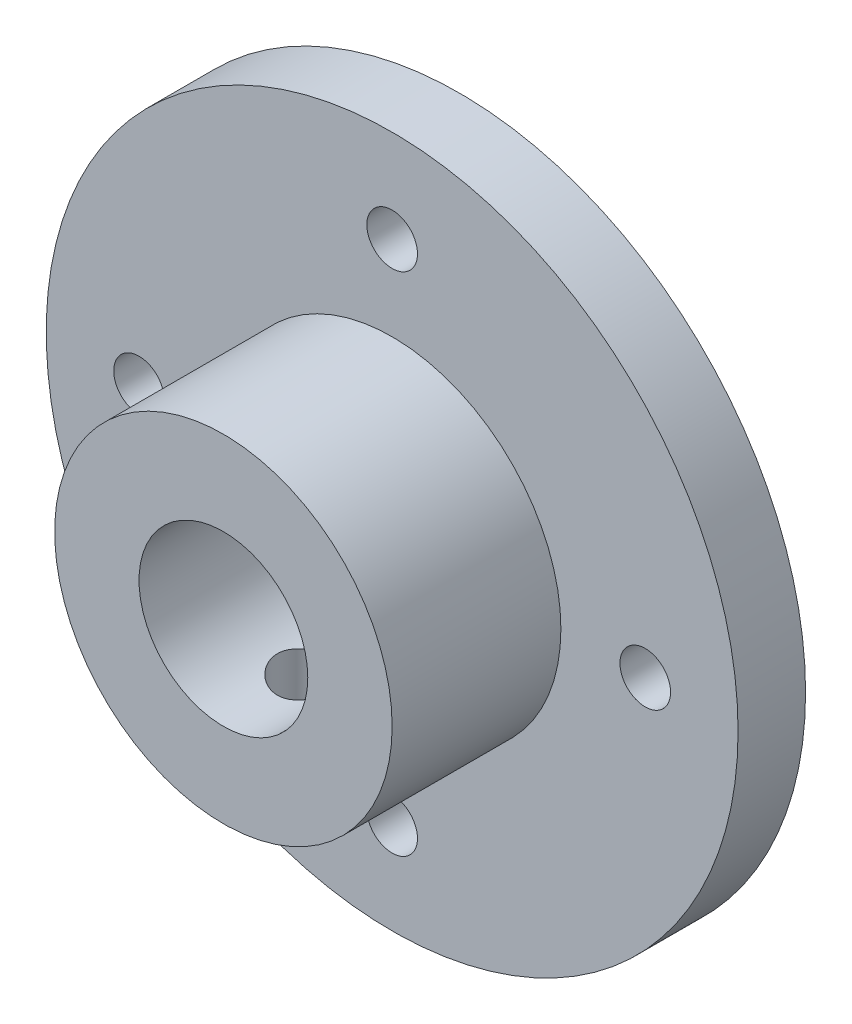
from build123d import *

# Parameters (mm, degrees)
EXTRUDE_1_DEPTH     = 4
SKETCH_2_R          = 10
SKETCH_2_R_2        = 5
EXTRUDE_2_DEPTH     = 10
SKETCH_3_R          = 1.8
CUT_EXTRUDE_1_DEPTH = 13


with BuildPart() as part:
    # 草图1 → 凸台-拉伸1 (new body)
    with BuildSketch(Plane.XY):
        with BuildLine():
            ThreePointArc((-20.5, 0), (0, -20.5), (20.5, 0))
            ThreePointArc((20.5, 0), (0, 20.5), (-20.5, 0))
        make_face()
        with BuildLine():
            ThreePointArc((-16.5, 0), (-15, -1.5), (-13.5, 0))
            ThreePointArc((-13.5, 0), (-15, 1.5), (-16.5, 0))
        make_face(mode=Mode.SUBTRACT)
        with BuildLine():
            ThreePointArc((-1.5, -15), (0, -16.5), (1.5, -15))
            ThreePointArc((1.5, -15), (0, -13.5), (-1.5, -15))
        make_face(mode=Mode.SUBTRACT)
        with BuildLine():
            ThreePointArc((13.5, 0), (15, -1.5), (16.5, 0))
            ThreePointArc((16.5, 0), (15, 1.5), (13.5, 0))
        make_face(mode=Mode.SUBTRACT)
        with BuildLine():
            ThreePointArc((-1.5, 15), (0, 13.5), (1.5, 15))
            ThreePointArc((1.5, 15), (0, 16.5), (-1.5, 15))
        make_face(mode=Mode.SUBTRACT)
        with BuildLine():
            ThreePointArc((-5, 0), (0, -5), (5, 0))
            ThreePointArc((5, 0), (0, 5), (-5, 0))
        make_face(mode=Mode.SUBTRACT)
    extrude(amount=EXTRUDE_1_DEPTH)

    # 草图2 → 凸台-拉伸2 (add)
    with BuildSketch(Plane.XY.offset(4)):
        Circle(SKETCH_2_R)
        Circle(SKETCH_2_R_2, mode=Mode.SUBTRACT)
    extrude(amount=EXTRUDE_2_DEPTH)

    # 草图3 → 切除-拉伸1 (cut)
    with BuildSketch(Plane(origin=(0, 0, 0), x_dir=(1, 0, 0), z_dir=(0, 1, 0))):
        with Locations(Location((0, -9, 0), (0, 0, 270))):
            Circle(SKETCH_3_R)
    extrude(amount=-CUT_EXTRUDE_1_DEPTH, mode=Mode.SUBTRACT)


solid = part.part
